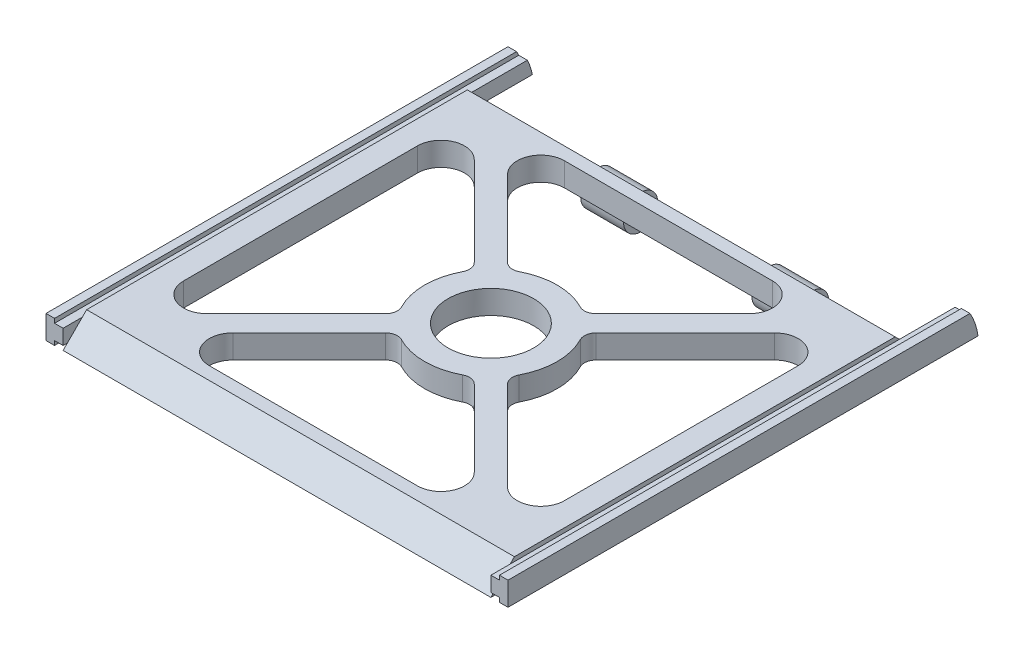
from build123d import *

# Parameters (mm, degrees)
BOSS_EXTRUDE1_DEPTH = 5.5
SKETCH4_W           = 2
SKETCH4_H           = 1
CUT_EXTRUDE2_DEPTH  = 110
SKETCH5_R           = 10
CUT_EXTRUDE3_DEPTH  = 110
CUT_EXTRUDE4_START  = -4
CUT_EXTRUDE4_DEPTH  = 100
FILLET3_R           = 5.5
FILLET4_R           = 2.75
BOSS_EXTRUDE2_START = -29
SKETCH7_R           = 2
BOSS_EXTRUDE2_DEPTH = 10
BOSS_EXTRUDE3_START = -69
SKETCH7_3_R         = 2
BOSS_EXTRUDE3_DEPTH = 10
CUT_EXTRUDE5_DEPTH  = 155.389928428


with BuildPart() as part:
    # Sketch1 → Boss-Extrude1 (new body)
    with BuildSketch(Plane(origin=(0, 0, 0), x_dir=(1, 0, 0), z_dir=(0, 1, 0))):
        Polygon((0, 110), (4, 110), (4, 100), (104, 100), (104, 110), (108, 110), (108, 0), (0, 0), align=None)
    extrude(amount=BOSS_EXTRUDE1_DEPTH)

    # Sketch4 → Cut-Extrude2 (cut)
    with BuildSketch(Plane(origin=(0, 0, -110), x_dir=(-1, 0, 0), z_dir=(0, 0, -1))):
        with Locations((-3, 0.5)):
            Rectangle(SKETCH4_W, SKETCH4_H)
        with Locations((-3, 5)):
            Rectangle(SKETCH4_W, SKETCH4_H)
        with Locations((-105, 5)):
            Rectangle(SKETCH4_W, SKETCH4_H)
        with Locations((-105, 0.5)):
            Rectangle(SKETCH4_W, SKETCH4_H)
    extrude(amount=-CUT_EXTRUDE2_DEPTH, mode=Mode.SUBTRACT)

    # Sketch5 → Cut-Extrude3 (cut)
    with BuildSketch(Plane(origin=(0, 5.5, 0), x_dir=(1, 0, 0), z_dir=(0, 1, 0))):
        with Locations((54, 50)):
            Circle(SKETCH5_R)
        with BuildLine():
            Line((41.269180349, 41.158267646), (9.5, 9.389087297))
            Line((9.5, 9.389087297), (9.5, 90.610912703))
            Line((9.5, 90.610912703), (41.269180349, 58.841732354))
            ThreePointArc((41.269180349, 58.841732354), (38.5, 50), (41.269180349, 41.158267646))
        make_face()
        with BuildLine():
            Line((98.5, 90.610912703), (98.5, 9.389087297))
            Line((98.5, 9.389087297), (66.730819651, 41.158267646))
            ThreePointArc((66.730819651, 41.158267646), (69.5, 50), (66.730819651, 58.841732354))
            Line((66.730819651, 58.841732354), (98.5, 90.610912703))
        make_face()
        with BuildLine():
            Line((45.158267646, 62.730819651), (16.389087297, 91.5))
            Line((16.389087297, 91.5), (91.610912703, 91.5))
            Line((91.610912703, 91.5), (62.841732354, 62.730819651))
            ThreePointArc((62.841732354, 62.730819651), (54, 65.5), (45.158267646, 62.730819651))
        make_face()
        with BuildLine():
            Line((16.389087297, 8.5), (91.610912703, 8.5))
            Line((91.610912703, 8.5), (62.841732354, 37.269180349))
            ThreePointArc((62.841732354, 37.269180349), (54, 34.5), (45.158267646, 37.269180349))
            Line((45.158267646, 37.269180349), (16.389087297, 8.5))
        make_face()
    extrude(amount=-CUT_EXTRUDE3_DEPTH, mode=Mode.SUBTRACT)

    # Sketch6 → Cut-Extrude4 (cut)
    with BuildSketch(Plane(origin=(108, 0, 0), x_dir=(0, 0, -1), z_dir=(1, 0, 0)).offset(CUT_EXTRUDE4_START)):
        Polygon((0, 0), (5.5, 5.5), (0, 5.5), align=None)
        Polygon((100, 5.5), (100, 0), (94.5, 5.5), align=None)
    extrude(amount=-CUT_EXTRUDE4_DEPTH, mode=Mode.SUBTRACT)

    # Fillet3
    fillet3_edges = [part.edges().sort_by_distance(p)[0] for p in [
        (91.610912703, 2.75, -8.5),
        (98.5, 2.75, -9.389087297),
        (98.5, 2.75, -90.610912703),
        (91.610912703, 2.75, -91.5),
        (16.389087297, 2.75, -91.5),
        (9.5, 2.75, -90.610912703),
        (9.5, 2.75, -9.389087297),
        (16.389087297, 2.75, -8.5),
    ]]
    fillet(fillet3_edges, radius=FILLET3_R)

    # Fillet4
    fillet4_edges = [part.edges().sort_by_distance(p)[0] for p in [
        (66.730819651, 2.75, -41.158267646),
        (66.730819651, 2.75, -58.841732354),
        (62.841732354, 2.75, -62.730819651),
        (45.158267646, 2.75, -62.730819651),
        (41.269180349, 2.75, -41.158267646),
        (41.269180349, 2.75, -58.841732354),
        (62.841732354, 2.75, -37.269180349),
        (45.158267646, 2.75, -37.269180349),
    ]]
    fillet(fillet4_edges, radius=FILLET4_R)

    # Sketch7 → Boss-Extrude2 (add)
    with BuildSketch(Plane(origin=(108, 0, 0), x_dir=(0, 0, -1), z_dir=(1, 0, 0)).offset(BOSS_EXTRUDE2_START)):
        with BuildLine():
            Line((100, 0), (97, 0))
            Line((97, 0), (97, -1.854248689))
            ThreePointArc((97, -1.854248689), (101.645751311, -8.145751311), (100, -0.5))
            Line((100, -0.5), (100, 0))
        make_face()
        with Locations((100, -4.5)):
            Circle(SKETCH7_R, mode=Mode.SUBTRACT)
    extrude(amount=-BOSS_EXTRUDE2_DEPTH)

    # Sketch7<3> → Boss-Extrude3 (add)
    with BuildSketch(Plane(origin=(108, 0, 0), x_dir=(0, 0, -1), z_dir=(1, 0, 0)).offset(BOSS_EXTRUDE3_START)):
        with BuildLine():
            Line((100, 0), (97, 0))
            Line((97, 0), (97, -1.854248689))
            ThreePointArc((97, -1.854248689), (101.645751311, -8.145751311), (100, -0.5))
            Line((100, -0.5), (100, 0))
        make_face()
        with Locations((100, -4.5)):
            Circle(SKETCH7_3_R, mode=Mode.SUBTRACT)
    extrude(amount=-BOSS_EXTRUDE3_DEPTH)

    # Sketch9 → Cut-Extrude5 (cut, through all)
    with BuildSketch(Plane(origin=(108, 0, 0), x_dir=(0, 0, -1), z_dir=(1, 0, 0))):
        with BuildLine():
            Line((110, -2), (115, -2))
            Line((115, -2), (115, 18))
            Line((115, 18), (95, 18))
            Line((95, 18), (95, 13))
            ThreePointArc((95, 13), (105.606601718, 8.606601718), (110, -2))
        make_face()
    extrude(amount=-CUT_EXTRUDE5_DEPTH, mode=Mode.SUBTRACT)


solid = part.part
